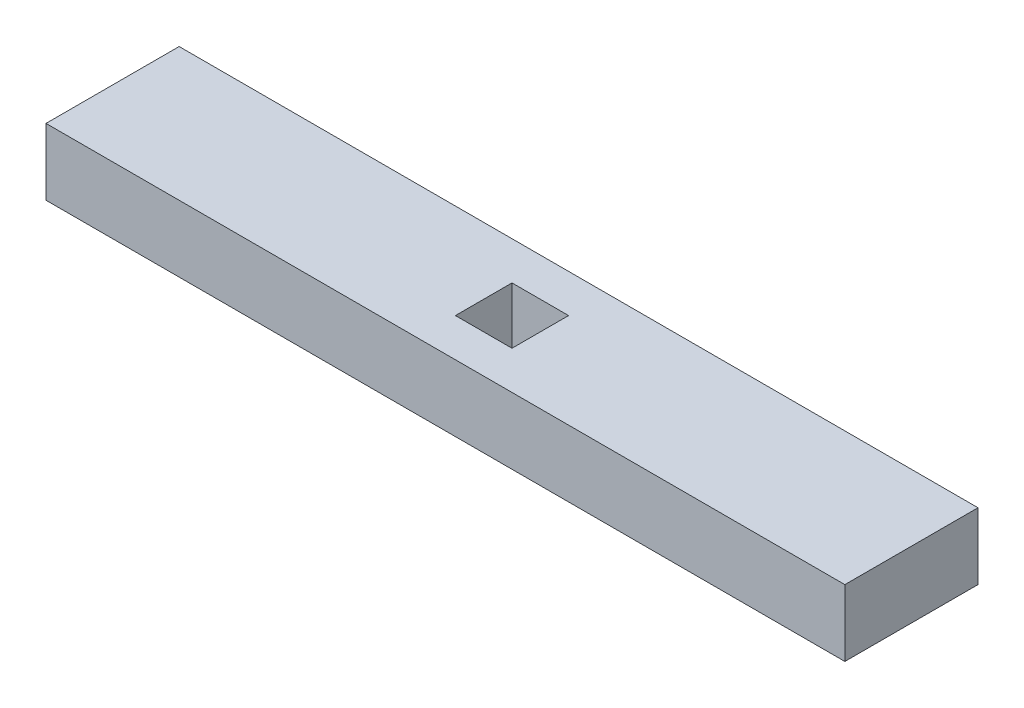
from build123d import *

# Parameters (mm, degrees)
SKETCH_2_W      = 60
SKETCH_2_H      = 10
SKETCH_2_W_2    = 4.25
SKETCH_2_H_2    = 4.25
EXTRUDE_1_DEPTH = 5


with BuildPart() as part:
    # 草图2 → 凸台-拉伸1 (new body)
    with BuildSketch(Plane(origin=(0, 0, 0), x_dir=(1, 0, 0), z_dir=(0, 1, 0))):
        Rectangle(SKETCH_2_W, SKETCH_2_H)
        Rectangle(SKETCH_2_W_2, SKETCH_2_H_2, mode=Mode.SUBTRACT)
    extrude(amount=EXTRUDE_1_DEPTH)


solid = part.part
